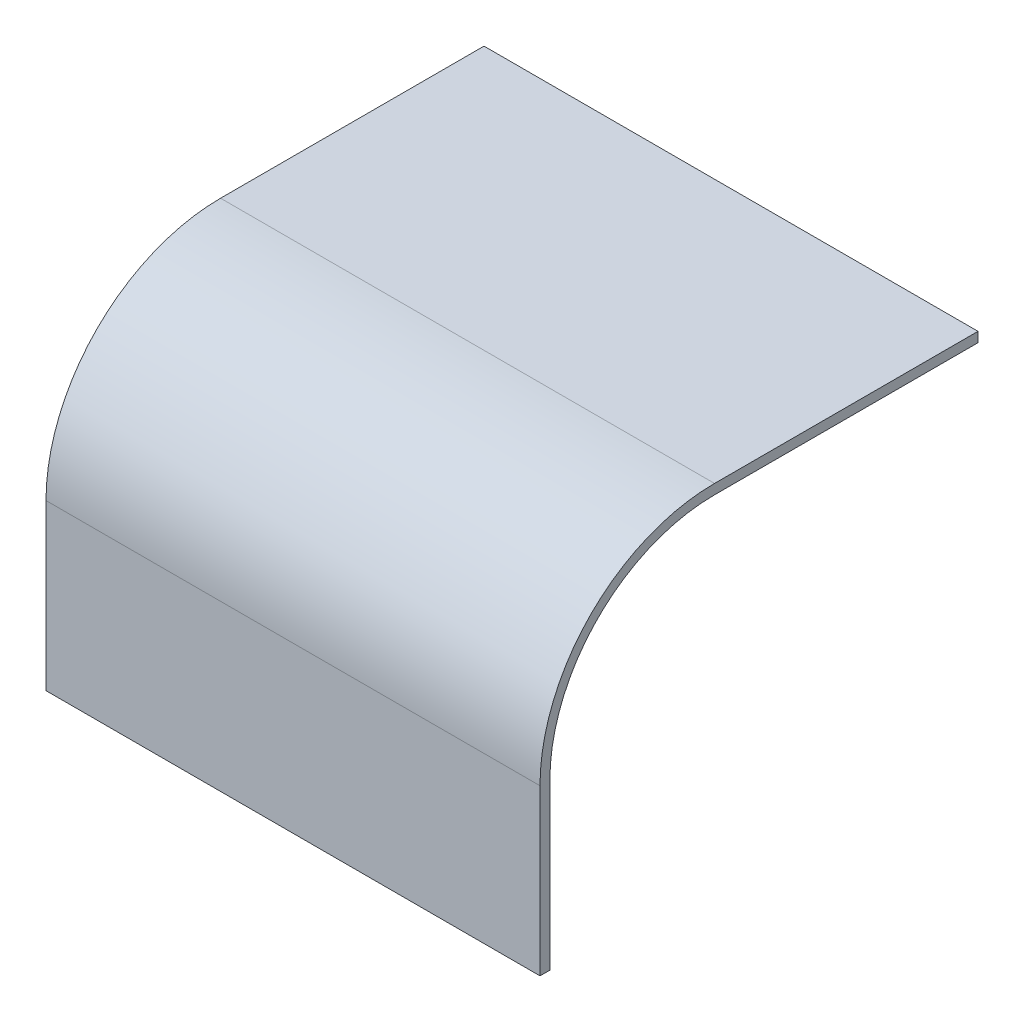
from build123d import *

# Parameters (mm, degrees)
SALIENTE_EXTRUIR1_DEPTH = 75


with BuildPart() as part:
    # Croquis1 → Saliente-Extruir1 (new, symmetric)
    with BuildSketch(Plane(origin=(-7.305693887, -32.456719669, 940.926254751), x_dir=(0, 0, -1), z_dir=(1, 0, 0))):
        with BuildLine():
            Line((-80, 100), (0, 100))
            Line((0, 100), (0, 103))
            Line((0, 103), (-80, 103))
            ThreePointArc((-80, 103), (-117.476659403, 87.476659403), (-133, 50))
            Line((-133, 50), (-133, 0))
            Line((-133, 0), (-130, 0))
            Line((-130, 0), (-130, 50))
            ThreePointArc((-130, 50), (-115.355339059, 85.355339059), (-80, 100))
        make_face()
    extrude(amount=SALIENTE_EXTRUIR1_DEPTH, both=True)


solid = part.part
